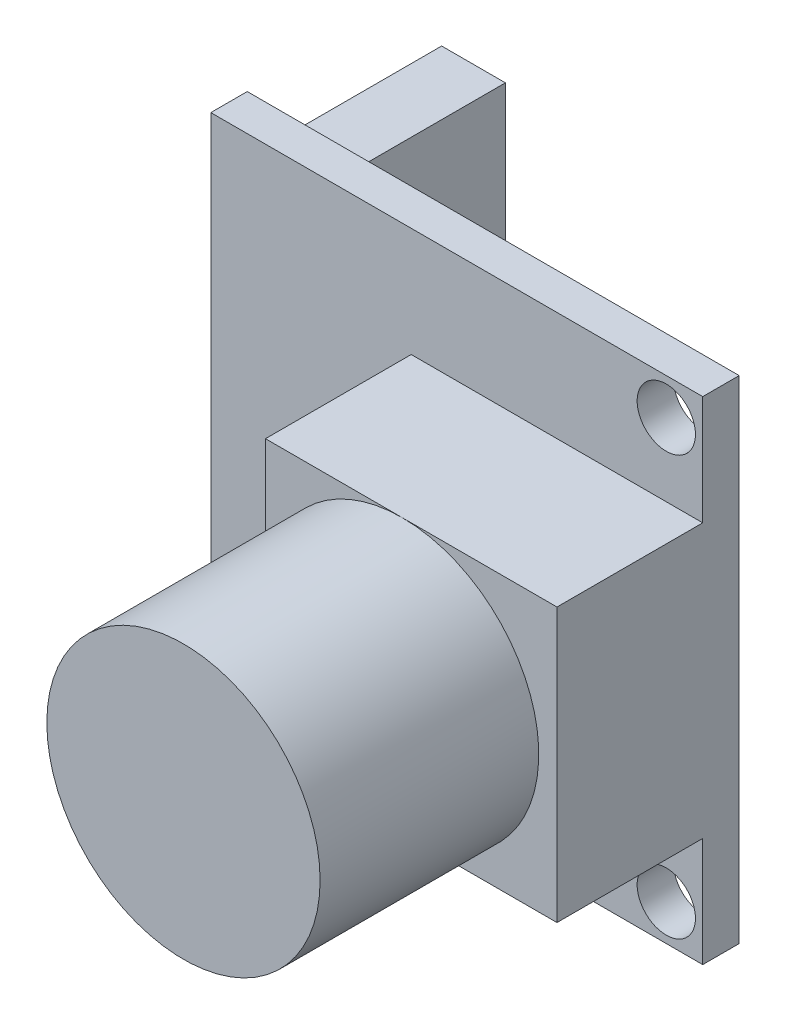
from build123d import *

# Parameters (mm, degrees)
SKETCH_1_W      = 27
SKETCH_1_H      = 27
SKETCH_1_R      = 1.6
EXTRUDE_1_DEPTH = 2
SKETCH_2_R      = 7.5
EXTRUDE_2_DEPTH = 20
SKETCH_3_W      = 16
SKETCH_3_H      = 15
EXTRUDE_3_DEPTH = 8
SKETCH_4_W      = 3.5
SKETCH_4_H      = 22
EXTRUDE_4_DEPTH = 10


with BuildPart() as part:
    # 草图1 → 凸台-拉伸1 (new body)
    with BuildSketch(Plane.XY):
        with Locations((255, 320)):
            Rectangle(SKETCH_1_W, SKETCH_1_H)
        with Locations((266.5, 331.5)):
            Circle(SKETCH_1_R, mode=Mode.SUBTRACT)
        with Locations((266.5, 308.5)):
            Circle(SKETCH_1_R, mode=Mode.SUBTRACT)
    extrude(amount=EXTRUDE_1_DEPTH)

    # 草图2 → 凸台-拉伸2 (add)
    with BuildSketch(Plane.XY.offset(2)):
        with Locations((260, 320)):
            Circle(SKETCH_2_R)
    extrude(amount=EXTRUDE_2_DEPTH)

    # 草图3 → 凸台-拉伸3 (add)
    with BuildSketch(Plane.XY.offset(2)):
        with Locations((260.5, 320)):
            Rectangle(SKETCH_3_W, SKETCH_3_H)
    extrude(amount=EXTRUDE_3_DEPTH)

    # 草图4 → 凸台-拉伸4 (add)
    with BuildSketch(Plane(origin=(0, 0, 0), x_dir=(-1, 0, 0), z_dir=(0, 0, -1))):
        with Locations((-243.92, 320)):
            Rectangle(SKETCH_4_W, SKETCH_4_H)
    extrude(amount=EXTRUDE_4_DEPTH)


solid = part.part
